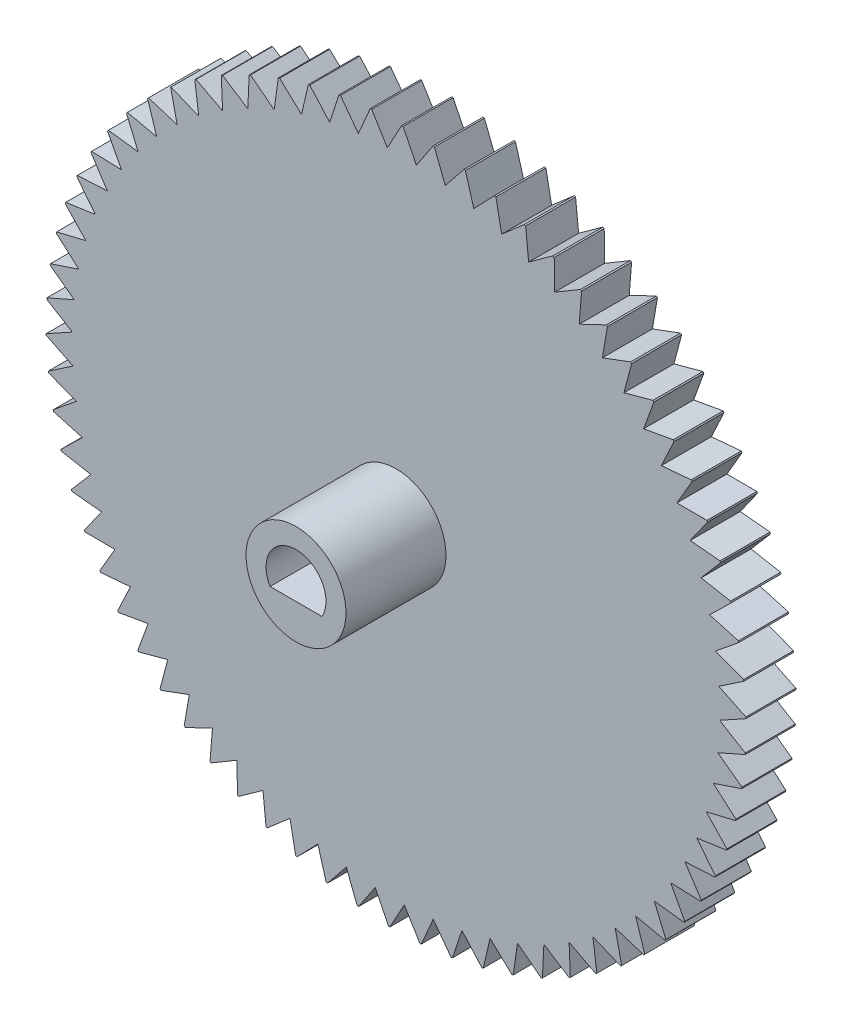
from build123d import *

# Parameters (mm, degrees)
SKETCH1_R           = 35
BOSS_EXTRUDE1_DEPTH = 5
CUT_EXTRUDE1_START  = -5
CUT_EXTRUDE1_DEPTH  = 55.749371855
CIRPATTERN1_COUNT   = 70
CIRPATTERN1_ANGLE   = 355.005
SKETCH3_R           = 5
BOSS_EXTRUDE2_DEPTH = 10
SKETCH4_R           = 3
CUT_EXTRUDE2_DEPTH  = 6
CUT_EXTRUDE4_DEPTH  = 9


with BuildPart() as part:
    # Sketch1 → Boss-Extrude1 (new body)
    with BuildSketch(Plane.XY):
        Circle(SKETCH1_R)
    extrude(amount=BOSS_EXTRUDE1_DEPTH)

    # Sketch2 → Cut-Extrude1 (cut)
    with BuildSketch(Plane.XY.offset(5).offset(CUT_EXTRUDE1_START)):
        Polygon((-195.50027104, 78.443296081), (-24.748737342, 24.748737342), (-21.886899044, 23.848803143), (-22.538452316, 26.777194909), (-61.413367252, 201.499640197), (-303.469140349, 465.252877722), (-437.556044137, 342.196533605), align=None)
    cut_extrude1 = extrude(amount=CUT_EXTRUDE1_DEPTH, mode=Mode.SUBTRACT)

    # CirPattern1: Cut-Extrude1 ×70 about axis
    cirpattern1_axis = Axis((0, 0, 5), (0, 0, 1))
    for i in range(1, CIRPATTERN1_COUNT):
        add(cut_extrude1.rotate(cirpattern1_axis, i * CIRPATTERN1_ANGLE / (CIRPATTERN1_COUNT - 1)), mode=Mode.SUBTRACT)

    # Sketch3 → Boss-Extrude2 (add)
    with BuildSketch(Plane.XY.offset(5)):
        Circle(SKETCH3_R)
    extrude(amount=BOSS_EXTRUDE2_DEPTH)

    # Sketch4 → Cut-Extrude2 (cut)
    with BuildSketch(Plane(origin=(0, 0, 0), x_dir=(-1, 0, 0), z_dir=(0, 0, -1))):
        Circle(SKETCH4_R)
    extrude(amount=-CUT_EXTRUDE2_DEPTH, mode=Mode.SUBTRACT)

    # Sketch5 → Cut-Extrude4 (cut)
    with BuildSketch(Plane(origin=(0, 0, 6), x_dir=(-1, 0, 0), z_dir=(0, 0, -1))):
        with BuildLine():
            Line((-2.598076211, -1.5), (2.598076211, -1.5))
            ThreePointArc((2.598076211, -1.5), (0, 3), (-2.598076211, -1.5))
        make_face()
    extrude(amount=-CUT_EXTRUDE4_DEPTH, mode=Mode.SUBTRACT)


solid = part.part
